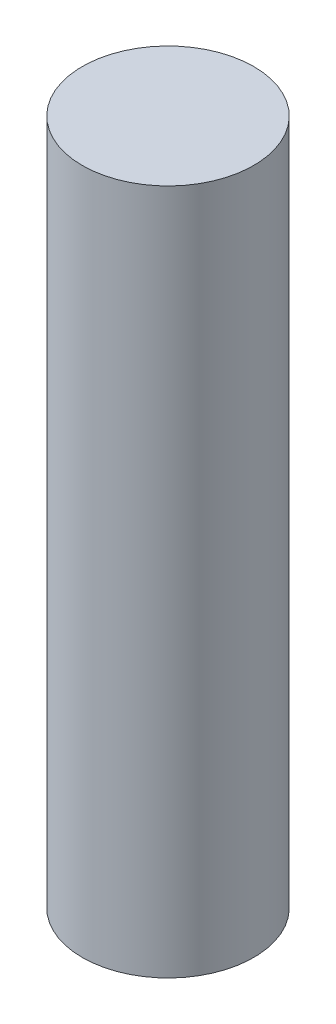
from build123d import *

# Parameters (mm, degrees)
SKETCH2_R           = 93.75
BOSS_EXTRUDE1_DEPTH = 750


with BuildPart() as part:
    # Sketch2 → Boss-Extrude1 (new body)
    with BuildSketch(Plane(origin=(0, 0, 0), x_dir=(1, 0, 0), z_dir=(0, 1, 0))):
        with Locations(Location((0, 0, 0), (0, 0, 270))):
            Circle(SKETCH2_R)
    extrude(amount=BOSS_EXTRUDE1_DEPTH)


solid = part.part
